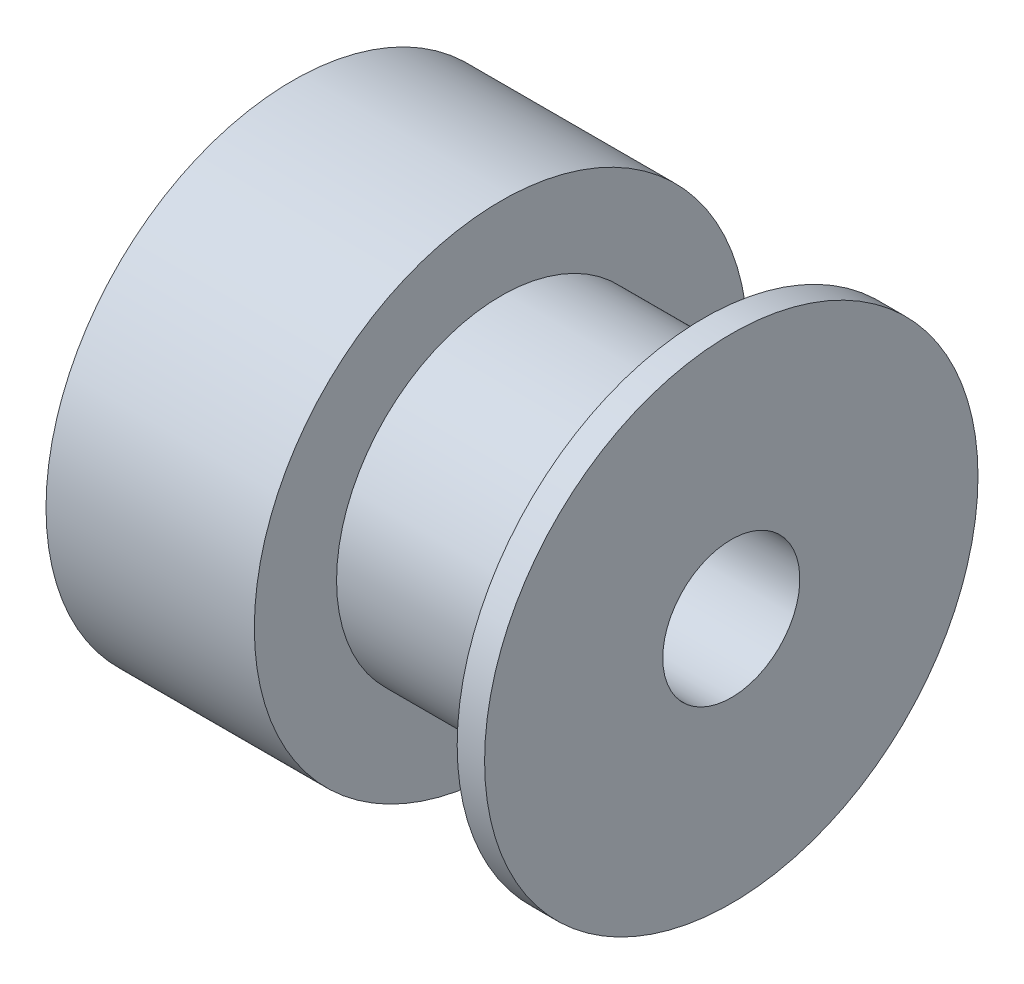
from build123d import *


with BuildPart() as part:
    # Çizim1 → Döndür1 (revolve)
    with BuildSketch(Plane.XY, mode=Mode.PRIVATE) as d_nd_r1_sk:
        Polygon((-0.4, 9), (-0.4, 6), (7, 6), (7, 9), (8, 9), (8, 2.5), (-8, 2.5), (-8, 9), align=None)
    revolve(d_nd_r1_sk.sketch.rotate(Axis((-5.180939652, 0, 0), (1, 0, 0)), 90), axis=Axis((-5.180939652, 0, 0), (1, 0, 0)))


solid = part.part
